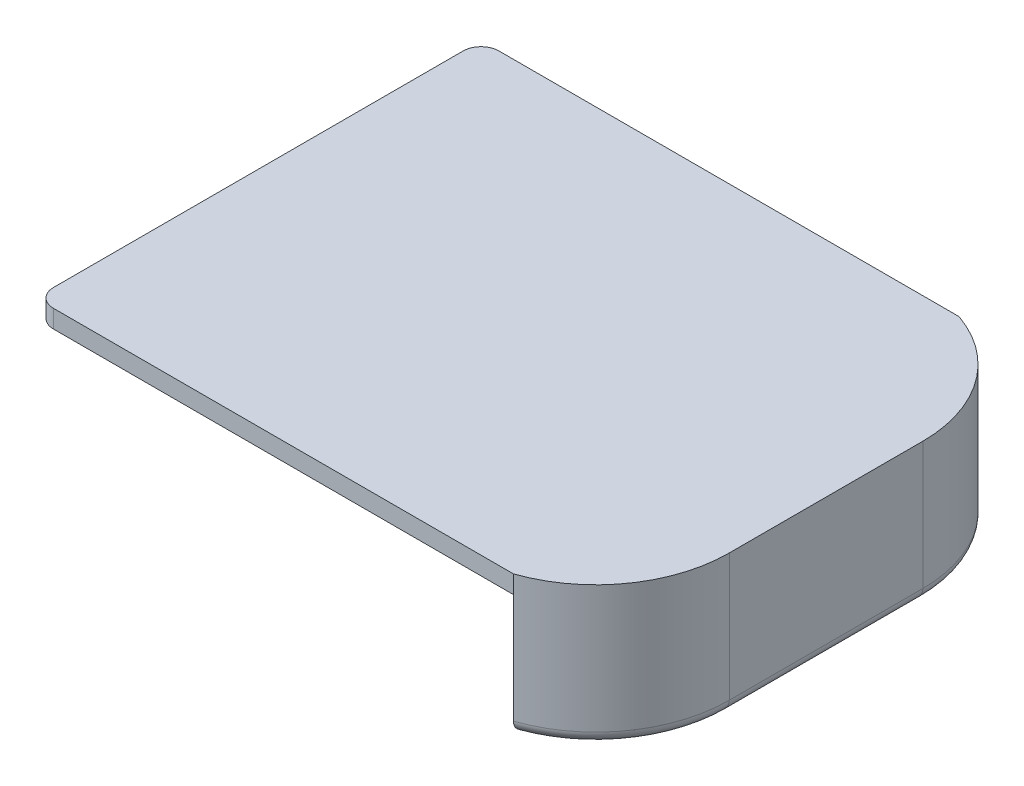
from build123d import *

# Parameters (mm, degrees)
BOSS_EXTRUDE1_DEPTH = 15.3
SKETCH4_W           = 7
SKETCH4_H           = 5.9
CUT_EXTRUDE1_DEPTH  = 78.461901488
SKETCH5_W           = 74.8
SKETCH5_H           = 19.8
BOSS_EXTRUDE2_DEPTH = 2
SKETCH6_W           = 74.8
SKETCH6_H           = 3
BOSS_EXTRUDE3_DEPTH = 37.2
SKETCH7_W           = 37.2
SKETCH7_H           = 3
BOSS_EXTRUDE4_DEPTH = 5
FILLET1_R           = 3
BOSS_EXTRUDE5_DEPTH = 23.3
FILLET2_R           = 2
SKETCH10_W          = 74.8
SKETCH10_H          = 19.8
CUT_EXTRUDE2_DEPTH  = 0.2
CUT_EXTRUDE3_DEPTH  = 5
CUT_EXTRUDE3_DRAFT  = 30
BOSS_EXTRUDE6_DEPTH = 15


with BuildPart() as part:
    # Sketch1 → Boss-Extrude1 (new body)
    with BuildSketch(Plane(origin=(0, 0, 0), x_dir=(1, 0, 0), z_dir=(0, 1, 0))):
        with BuildLine():
            Line((1.005677457, 13.08496015), (1.005677457, -6.71503985))
            Line((1.005677457, -6.71503985), (10.705677457, -6.71503985))
            Line((10.705677457, -6.71503985), (10.705677457, 7.68496015))
            ThreePointArc((10.705677457, 7.68496015), (24.690281417, 4.453424809), (33.705677457, -6.71503985))
            Line((33.705677457, -6.71503985), (75.805677457, -6.71503985))
            Line((75.805677457, -6.71503985), (75.805677457, 13.08496015))
            Line((75.805677457, 13.08496015), (1.005677457, 13.08496015))
        make_face()
    extrude(amount=BOSS_EXTRUDE1_DEPTH)

    # Sketch4 → Cut-Extrude1 (cut, through all)
    with BuildSketch(Plane(origin=(75.805677457, 0, 0), x_dir=(0, 0, -1), z_dir=(1, 0, 0))):
        with Locations((-3.21503985, 7.3)):
            Rectangle(SKETCH4_W, SKETCH4_H)
    extrude(amount=-CUT_EXTRUDE1_DEPTH, mode=Mode.SUBTRACT)

    # Sketch5 → Boss-Extrude2 (add)
    with BuildSketch(Plane(origin=(0, 15.3, 0), x_dir=(1, 0, 0), z_dir=(0, 1, 0))):
        with Locations((38.405677457, 3.18496015)):
            Rectangle(SKETCH5_W, SKETCH5_H)
    extrude(amount=BOSS_EXTRUDE2_DEPTH)

    # Sketch6 → Boss-Extrude3 (add)
    with BuildSketch(Plane(origin=(0, 0, -13.08496015), x_dir=(-1, 0, 0), z_dir=(0, 0, -1))):
        with Locations((-38.405677457, 18.8)):
            Rectangle(SKETCH6_W, SKETCH6_H)
    extrude(amount=-BOSS_EXTRUDE3_DEPTH)

    # Sketch7 → Boss-Extrude4 (add)
    with BuildSketch(Plane.ZY.offset(-1.005677457)):
        with Locations((5.51503985, 18.8)):
            Rectangle(SKETCH7_W, SKETCH7_H)
    extrude(amount=BOSS_EXTRUDE4_DEPTH)

    # Fillet1
    fillet1_edges = [part.edges().sort_by_distance(p)[0] for p in [
        (-3.994322543, 18.8, 24.11503985),
    ]]
    fillet(fillet1_edges, radius=FILLET1_R)

    # Sketch8 → Boss-Extrude5 (add)
    with BuildSketch(Plane(origin=(0, 20.3, 0), x_dir=(1, 0, 0), z_dir=(0, 1, 0))):
        with BuildLine():
            Line((75.805677457, 13.08496015), (90.805677457, 13.08496015))
            Line((90.805677457, 13.08496015), (90.805677457, -3.072659154))
            ThreePointArc((90.805677457, -3.072659154), (86.671822493, -15.993396221), (75.805677457, -24.11503985))
            Line((75.805677457, -24.11503985), (75.805677457, 13.08496015))
        make_face()
    extrude(amount=-BOSS_EXTRUDE5_DEPTH)

    # Fillet2
    fillet2_edges = [part.edges().sort_by_distance(p)[0] for p in [
        (90.805677457, -3, -5.006150498),
        (86.671822493, -3, 15.993396221),
    ]]
    fillet(fillet2_edges, radius=FILLET2_R)

    # Sketch10 → Cut-Extrude2 (cut)
    with BuildSketch(Plane(origin=(0, 0, 0), x_dir=(-1, 0, 0), z_dir=(0, -1, 0))):
        with Locations((-38.405677457, 3.18496015)):
            Rectangle(SKETCH10_W, SKETCH10_H)
    extrude(amount=-CUT_EXTRUDE2_DEPTH, mode=Mode.SUBTRACT)


with BuildPart() as cut_extrude3_tool:
    # Sketch11 → Cut-Extrude3 (with draft: the straight prism first)
    with BuildSketch(Plane(origin=(0, -3, 0), x_dir=(-1, 0, 0), z_dir=(0, -1, 0))):
        with BuildLine():
            Line((-75.805677457, 13.08496015), (-83.305677457, 13.08496015))
            Line((-83.305677457, 13.08496015), (-83.305677457, 8.08496015))
            ThreePointArc((-83.305677457, 8.08496015), (-80.312616551, 4.449551508), (-75.805677457, 3.08496015))
            Line((-75.805677457, 3.08496015), (-75.805677457, 13.08496015))
        make_face()
    extrude(amount=-CUT_EXTRUDE3_DEPTH)
    # Cut-Extrude3: the draft: its side faces are tilted about the plane it starts from
    cut_extrude3_sides = [cut_extrude3_tool.faces().sort_by_distance(p)[0] for p in [
        (75.805677457, -0.5, -8.08496015),
        (79.555677457, -0.5, -13.08496015),
        (83.305677457, -0.5, -10.58496015),
        (80.312616551, -0.5, -4.449551508),
    ]]
    draft(cut_extrude3_sides, Plane(origin=(0, -3, 0), x_dir=(-1, 0, 0), z_dir=(0, -1, 0)), CUT_EXTRUDE3_DRAFT)


with BuildPart() as part_1:
    add(part.part)

    # Cut-Extrude3: cut by cut_extrude3_tool
    add(cut_extrude3_tool.part, mode=Mode.SUBTRACT)

    # Sketch14 → Boss-Extrude6 (add)
    with BuildSketch(Plane(origin=(0, 0, -13.08496015), x_dir=(-1, 0, 0), z_dir=(0, 0, -1))):
        Polygon((-72.918926111, 2), (-73.958156595, 0.2), (-75.805677457, 0.2), (-75.805677457, 2), align=None)
    extrude(amount=-BOSS_EXTRUDE6_DEPTH)

    # Mirror1: part across plane


with BuildPart() as part_2:
    add(part_1.part)
    add(part_1.part.mirror(Plane(origin=(0, 15.3, -13.08496015), x_dir=(1, 0, 0), z_dir=(0, 0, -1))))


solid = part_2.part
